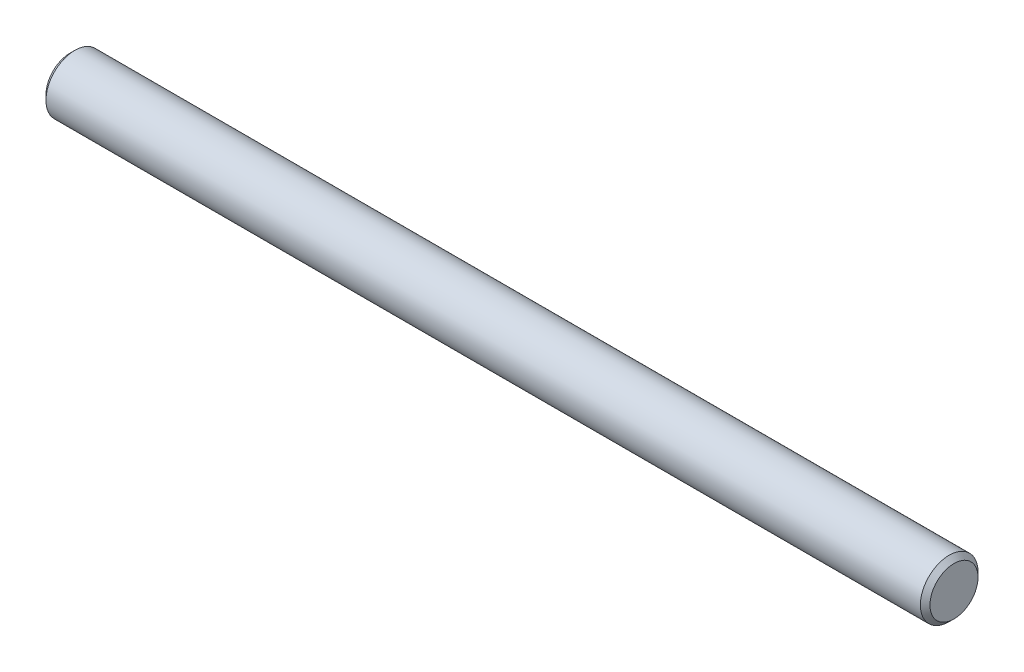
from build123d import *

# Parameters (mm, degrees)
SKETCH1_R           = 6
BOSS_EXTRUDE1_DEPTH = 184
CHAMFER1_SIZE       = 1


with BuildPart() as part:
    # Sketch1 → Boss-Extrude1 (new body)
    with BuildSketch(Plane(origin=(0, 0, 0), x_dir=(0, 0, -1), z_dir=(1, 0, 0))):
        Circle(SKETCH1_R)
    extrude(amount=BOSS_EXTRUDE1_DEPTH)

    # Chamfer1
    chamfer1_edges = [part.edges().sort_by_distance(p)[0] for p in [
        (0, 0, 6),
        (184, 0, 6),
    ]]
    chamfer(chamfer1_edges, length=CHAMFER1_SIZE)


solid = part.part
